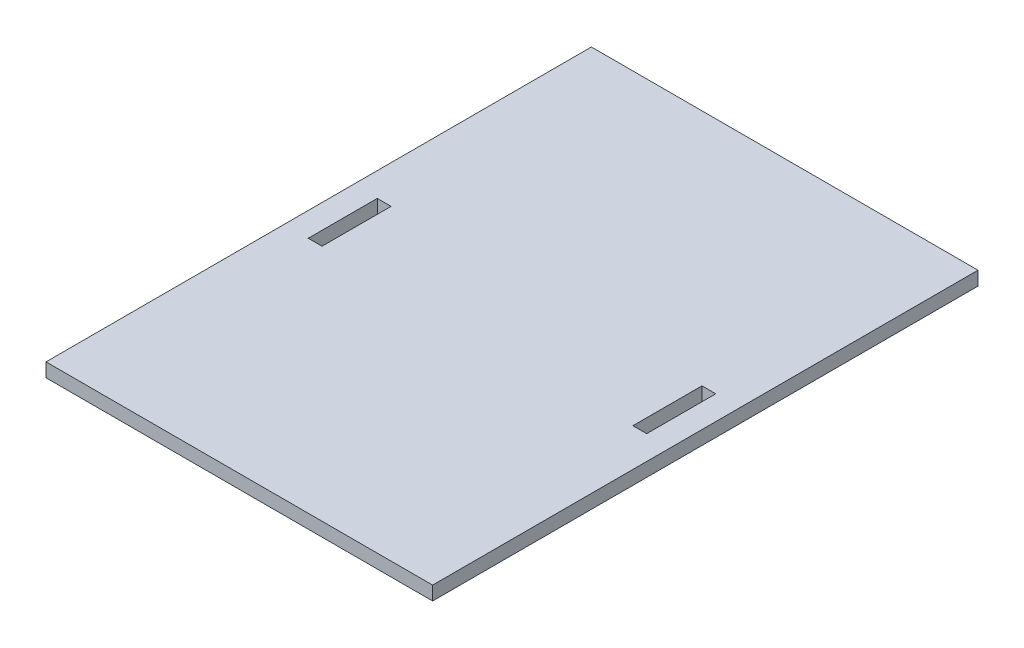
from build123d import *

# Parameters (mm, degrees)
SKETCH_1_W          = 56
SKETCH_1_H          = 2
EXTRUDE_1_DEPTH     = 79
SKETCH_3_W          = 2
SKETCH_3_H          = 10
CUT_EXTRUDE_1_DEPTH = 79


with BuildPart() as part:
    # 草图1 → 凸台-拉伸1 (new body)
    with BuildSketch(Plane.XY):
        with Locations((0, -53.953094154)):
            Rectangle(SKETCH_1_W, SKETCH_1_H)
    extrude(amount=EXTRUDE_1_DEPTH)

    # 草图3 → 切除-拉伸1 (cut)
    with BuildSketch(Plane.XZ.offset(54.953094154)):
        with Locations((-23.515, 39.5)):
            Rectangle(SKETCH_3_W, SKETCH_3_H)
        with Locations((23.515, 39.5)):
            Rectangle(SKETCH_3_W, SKETCH_3_H)
    extrude(amount=-CUT_EXTRUDE_1_DEPTH, mode=Mode.SUBTRACT)


solid = part.part
